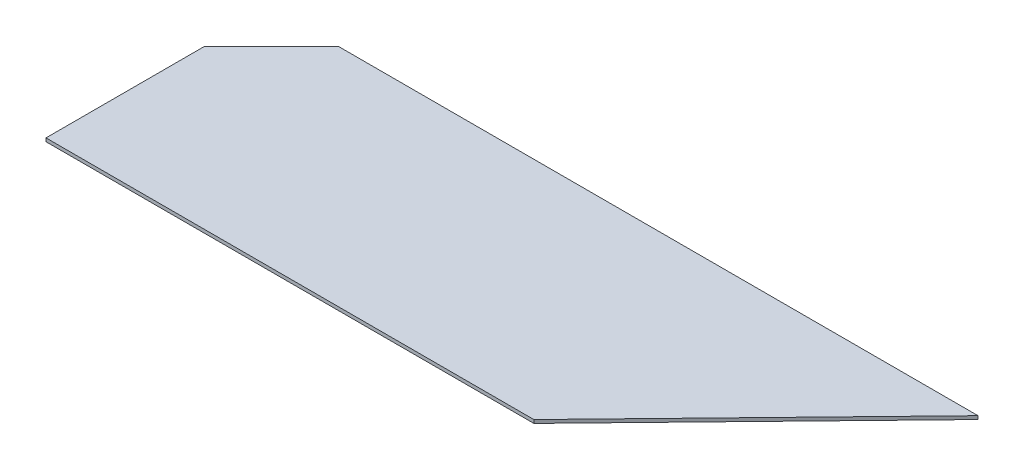
from build123d import *

# Parameters (mm, degrees)
BOSS_EXTRUDE1_DEPTH = 0.5


with BuildPart() as part:
    # Sketch1 → Boss-Extrude1 (new body)
    with BuildSketch(Plane(origin=(0, 0, 0), x_dir=(1, 0, 0), z_dir=(0, 1, 0))):
        Polygon((-23.208622398, -19.380822597), (49.291377602, -19.380822597), (81.791377602, 14.119177403), (-13.208622398, 14.119177403), (-23.208622398, 4.119177403), align=None)
    extrude(amount=BOSS_EXTRUDE1_DEPTH)


solid = part.part
